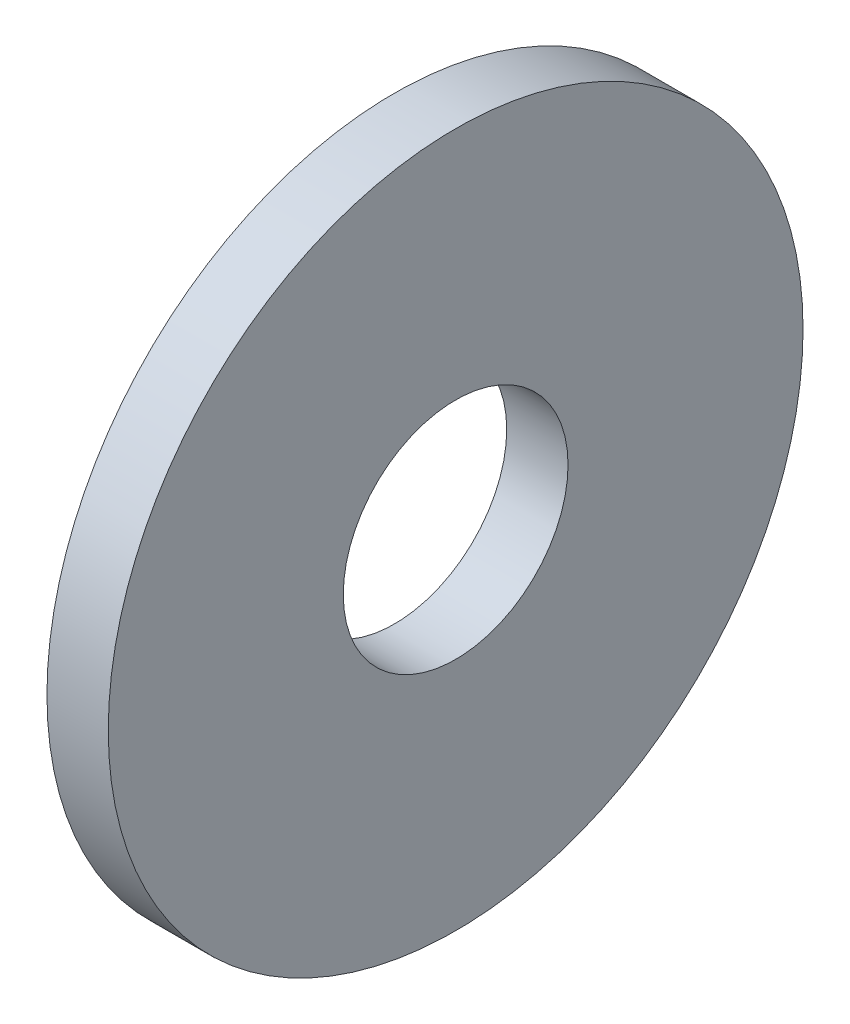
from build123d import *

# Parameters (mm, degrees)
SKETCH1_W = 3
SKETCH1_H = 11.5


with BuildPart() as part:
    # Sketch1 → Base-Revolve (revolve)
    with BuildSketch(Plane.XY, mode=Mode.PRIVATE) as base_revolve_sk:
        with Locations((-1.5, 11.25)):
            Rectangle(SKETCH1_W, SKETCH1_H)
    revolve(base_revolve_sk.sketch.rotate(Axis((-34.925, 0, 0), (1, 0, 0)), 90), axis=Axis((-34.925, 0, 0), (1, 0, 0)))


solid = part.part
